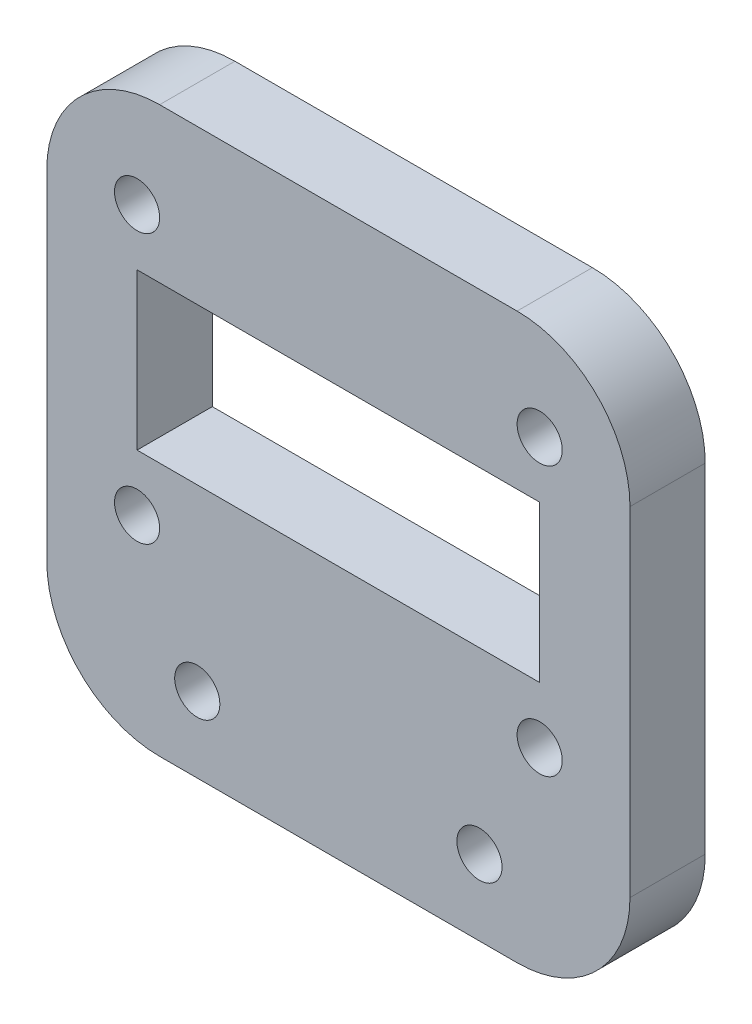
from build123d import *

# Parameters (mm, degrees)
SKETCH1_W           = 31
SKETCH1_H           = 30
SKETCH1_R           = 1.2
SKETCH1_W_2         = 21.4
SKETCH1_H_2         = 8.3
BOSS_EXTRUDE1_DEPTH = 4
SKETCH1_6_R         = 2.8
SKETCH1_6_R_2       = 1.2
CUT_EXTRUDE1_DEPTH  = 2
FILLET1_R           = 6


with BuildPart() as part:
    # Sketch1 → Boss-Extrude1 (new body)
    with BuildSketch(Plane.XY):
        Rectangle(SKETCH1_W, SKETCH1_H)
        with Locations((-10.7, -4.5)):
            Circle(SKETCH1_R, mode=Mode.SUBTRACT)
        with Locations((10.7, -4.5)):
            Circle(SKETCH1_R, mode=Mode.SUBTRACT)
        with Locations((-10.7, 9.8)):
            Circle(SKETCH1_R, mode=Mode.SUBTRACT)
        with Locations((0, 2.65)):
            Rectangle(SKETCH1_W_2, SKETCH1_H_2, mode=Mode.SUBTRACT)
        with Locations((10.7, 9.8)):
            Circle(SKETCH1_R, mode=Mode.SUBTRACT)
        with Locations((-7.5, -11)):
            Circle(SKETCH1_R, mode=Mode.SUBTRACT)
        with Locations((7.5, -11)):
            Circle(SKETCH1_R, mode=Mode.SUBTRACT)
    extrude(amount=BOSS_EXTRUDE1_DEPTH)

    # Sketch1<6> → Cut-Extrude1 (cut)
    # profile 1 of 2: a face of its own
    with BuildSketch(Plane.XY):
        with Locations((-7.5, -11)):
            Circle(SKETCH1_6_R)
        with Locations((-7.5, -11)):
            Circle(SKETCH1_6_R_2, mode=Mode.SUBTRACT)
    # profile 2 of 2: a face of its own
    with BuildSketch(Plane.XY):
        with Locations((7.5, -11)):
            Circle(SKETCH1_6_R)
        with Locations((7.5, -11)):
            Circle(SKETCH1_6_R_2, mode=Mode.SUBTRACT)
    extrude(amount=CUT_EXTRUDE1_DEPTH, mode=Mode.SUBTRACT)

    # Fillet1
    fillet1_edges = [part.edges().sort_by_distance(p)[0] for p in [
        (15.5, -15, 2),
        (-15.5, -15, 2),
        (-15.5, 15, 2),
        (15.5, 15, 2),
    ]]
    fillet(fillet1_edges, radius=FILLET1_R)


solid = part.part
